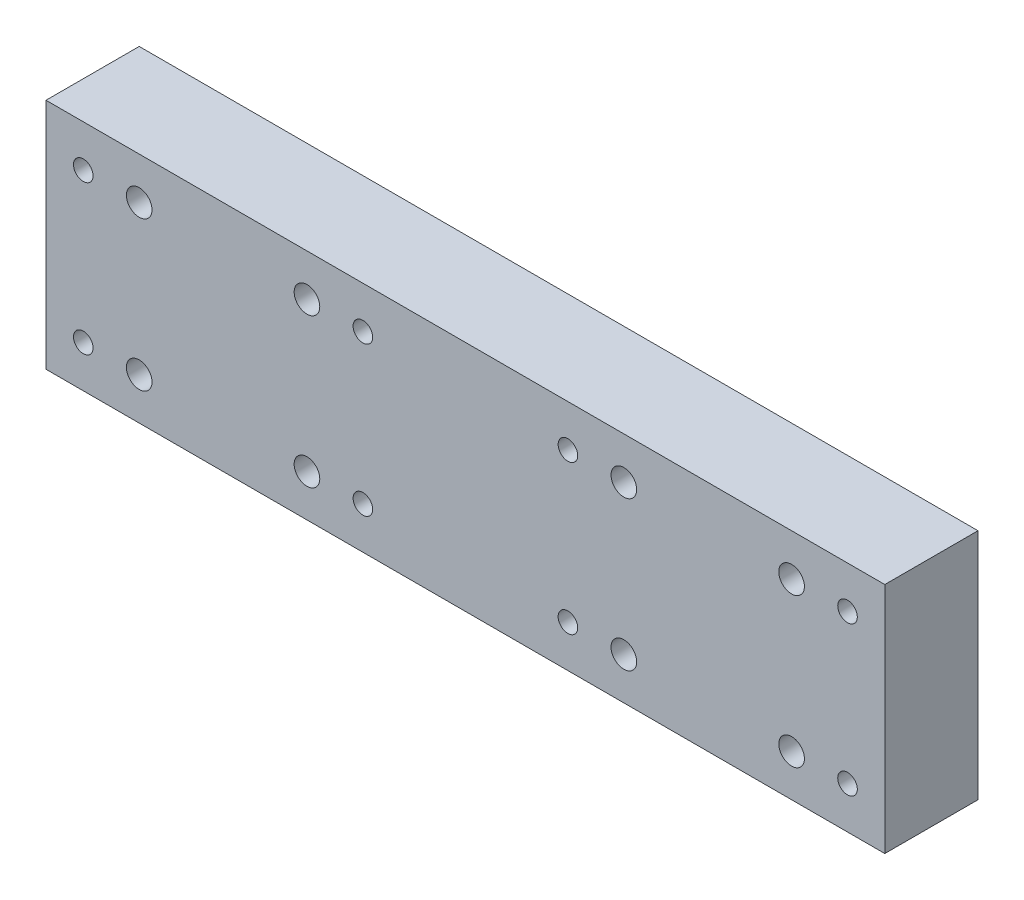
from build123d import *

# Parameters (mm, degrees)
SKIZZE1_W                            = 180
SKIZZE1_H                            = 50
AUFSATZ_LINEAR_AUSTRAGEN1_DEPTH      = 20
SKIZZE2_R                            = 2.75
SCHNITT_LINEAR_AUSTRAGEN1_DEPTH      = 40
SKIZZE3_R                            = 5
SCHNITT_LINEAR_AUSTRAGEN2_DEPTH      = 6
F_4_2_4_2_DURCHMESSER_BOHRUNG1_D     = 4.2
F_4_2_4_2_DURCHMESSER_BOHRUNG1_DEPTH = 34
F_4_2_4_2_DURCHMESSER_BOHRUNG1_TIP   = 1.2618073


with BuildPart() as part:
    # Skizze1 → Aufsatz-Linear austragen1 (new body)
    with BuildSketch(Plane.XY):
        with Locations((0, 25)):
            Rectangle(SKIZZE1_W, SKIZZE1_H)
    extrude(amount=AUFSATZ_LINEAR_AUSTRAGEN1_DEPTH)

    # Skizze2 → Schnitt-Linear austragen1 (cut)
    with BuildSketch(Plane.XY.offset(20)):
        with Locations((34, 9)):
            Circle(SKIZZE2_R)
        with Locations((70, 9)):
            Circle(SKIZZE2_R)
        with Locations(Location((70, 41, 0), (0, 0, 180))):
            Circle(SKIZZE2_R)
        with Locations(Location((34, 41, 0), (0, 0, 180))):
            Circle(SKIZZE2_R)
        with Locations(Location((-34, 9, 0), (0, 0, 180))):
            Circle(SKIZZE2_R)
        with Locations(Location((-70, 9, 0), (0, 0, 180))):
            Circle(SKIZZE2_R)
        with Locations((-70, 41)):
            Circle(SKIZZE2_R)
        with Locations((-34, 41)):
            Circle(SKIZZE2_R)
    extrude(amount=-SCHNITT_LINEAR_AUSTRAGEN1_DEPTH, mode=Mode.SUBTRACT)

    # Skizze3 → Schnitt-Linear austragen2 (cut)
    with BuildSketch(Plane.XY):
        with Locations((-70, 41)):
            Circle(SKIZZE3_R)
        with Locations((-34, 41)):
            Circle(SKIZZE3_R)
        with Locations((34, 41)):
            Circle(SKIZZE3_R)
        with Locations((70, 41)):
            Circle(SKIZZE3_R)
        with Locations((70, 9)):
            Circle(SKIZZE3_R)
        with Locations((34, 9)):
            Circle(SKIZZE3_R)
        with Locations((-34, 9)):
            Circle(SKIZZE3_R)
        with Locations((-70, 9)):
            Circle(SKIZZE3_R)
    extrude(amount=SCHNITT_LINEAR_AUSTRAGEN2_DEPTH, mode=Mode.SUBTRACT)

    # Ø4.2 (4.2) Durchmesser Bohrung1
    with Locations(Plane(origin=(0, 0, 0), x_dir=(-1, 0, 0), z_dir=(0, 0, -1))):
        with Locations((-22, 9), (82, 41), (22, 41), (82, 9), (22, 9), (-82, 9), (-82, 41), (-22, 41)):
            Hole(F_4_2_4_2_DURCHMESSER_BOHRUNG1_D / 2, depth=F_4_2_4_2_DURCHMESSER_BOHRUNG1_DEPTH)
            with Locations((0, 0, -(F_4_2_4_2_DURCHMESSER_BOHRUNG1_DEPTH + F_4_2_4_2_DURCHMESSER_BOHRUNG1_TIP / 2))):  # 118° drill point
                Cone(0, F_4_2_4_2_DURCHMESSER_BOHRUNG1_D / 2, F_4_2_4_2_DURCHMESSER_BOHRUNG1_TIP, mode=Mode.SUBTRACT)


solid = part.part
